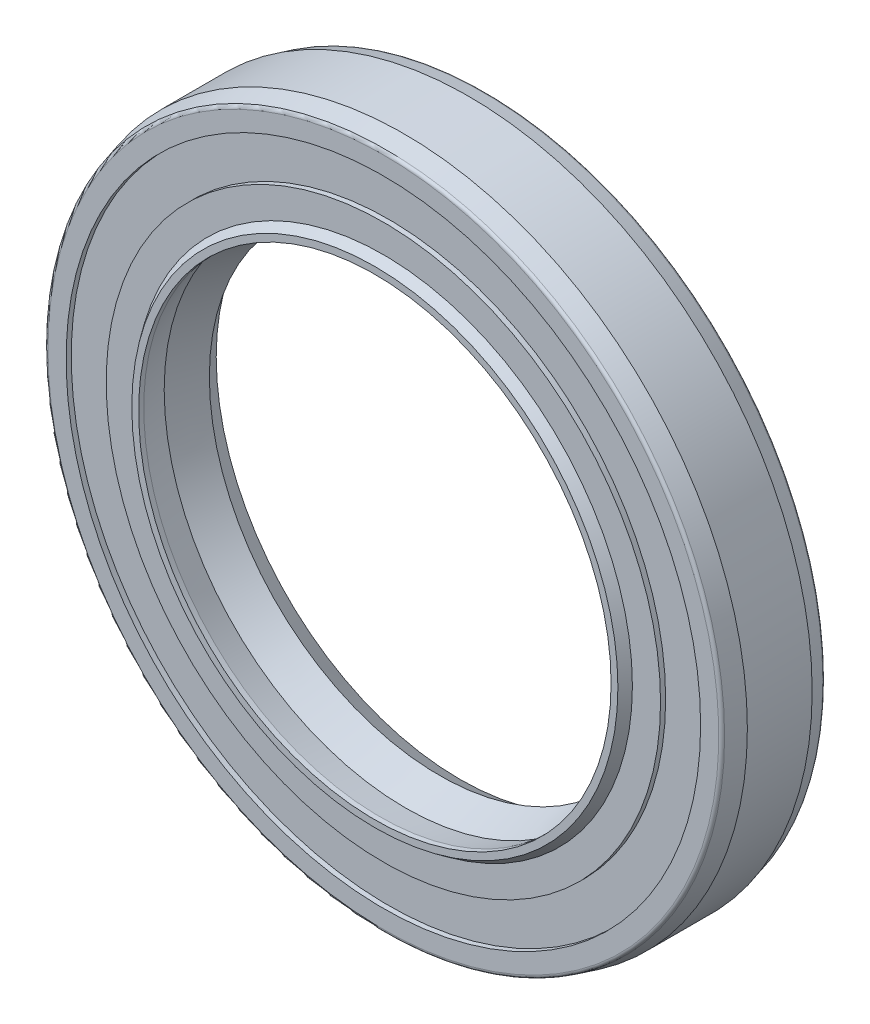
from build123d import *

# Parameters (mm, degrees)
CUT_EXTRUDE1_START = -4.2
CUT_EXTRUDE1_DEPTH = 4.2
CIRPATTERN1_COUNT  = 8
FILLET1_R          = 0.2


with BuildPart() as part:
    # Sketch1 → Revolve1 (revolve)
    with BuildSketch(Plane(origin=(0, 0, 0), x_dir=(0, 0, -1), z_dir=(1, 0, 0)), mode=Mode.PRIVATE) as revolve1_sk:
        with BuildLine():
            Line((0, 14.6), (0, 16.25))
            Line((0, 16.25), (0.3, 16.25))
            Line((0.3, 16.25), (0.3, 18.6))
            Line((0.3, 18.6), (0, 18.6))
            Line((0, 18.6), (0, 19.818460969))
            Line((0, 19.818460969), (1.2, 20.14))
            Line((1.2, 20.14), (5, 20.14))
            Line((5, 20.14), (6, 19.872050808))
            Line((6, 19.872050808), (6, 18.25))
            Line((6, 18.25), (5.5, 18.25))
            Line((5.5, 18.25), (5.5, 17.75))
            Line((5.5, 17.75), (2.4, 17.75))
            ThreePointArc((2.4, 17.75), (2.117157288, 17.632842712), (2, 17.35))
            Line((2, 17.35), (2, 15.2))
            Line((2, 15.2), (2.3, 15.2))
            ThreePointArc((2.3, 15.2), (3.249937225, 16.198746073), (4.294987437, 15.3))
            Line((4.294987437, 15.3), (4.5, 15.3))
            Line((4.5, 15.3), (4.5, 14.3))
            Line((4.5, 14.3), (3.297700441, 13.5))
            Line((3.297700441, 13.5), (1.3, 14.15))
            Line((1.3, 14.15), (-0.2, 13.85))
            Line((-0.2, 13.85), (-0.5, 13.85))
            Line((-0.5, 13.85), (-0.5, 14.25))
            Line((-0.5, 14.25), (0, 14.6))
        make_face()
    revolve(revolve1_sk.sketch.rotate(Axis((0, 0, 0), (0, 0, -1)), 90), axis=Axis((0, 0, 0), (0, 0, -1)))

    # Sketch3 → Cut-Extrude1 (cut)
    with BuildSketch(Plane(origin=(0, 0, -6), x_dir=(-1, 0, 0), z_dir=(0, 0, -1)).offset(CUT_EXTRUDE1_START)):
        with BuildLine():
            Line((-18.207141456, -1.25), (-16.3, -1.25))
            Line((-16.3, -1.25), (-16.3, 1.25))
            Line((-16.3, 1.25), (-18.207141456, 1.25))
            ThreePointArc((-18.207141456, 1.25), (-18.25, 0), (-18.207141456, -1.25))
        make_face()
    cut_extrude1 = extrude(amount=CUT_EXTRUDE1_DEPTH, mode=Mode.SUBTRACT)

    # CirPattern1: Cut-Extrude1 ×8 about axis
    cirpattern1_axis = Axis((0, 0, 0), (0, 0, 1))
    for i in range(1, CIRPATTERN1_COUNT):
        add(cut_extrude1.rotate(cirpattern1_axis, i * 360 / CIRPATTERN1_COUNT), mode=Mode.SUBTRACT)

    # Fillet1
    fillet1_edges = [part.edges().sort_by_distance(p)[0] for p in [
        (-19.872050808, 0, -6),
        (-19.818460969, 0, 0),
    ]]
    fillet(fillet1_edges, radius=FILLET1_R)


solid = part.part
